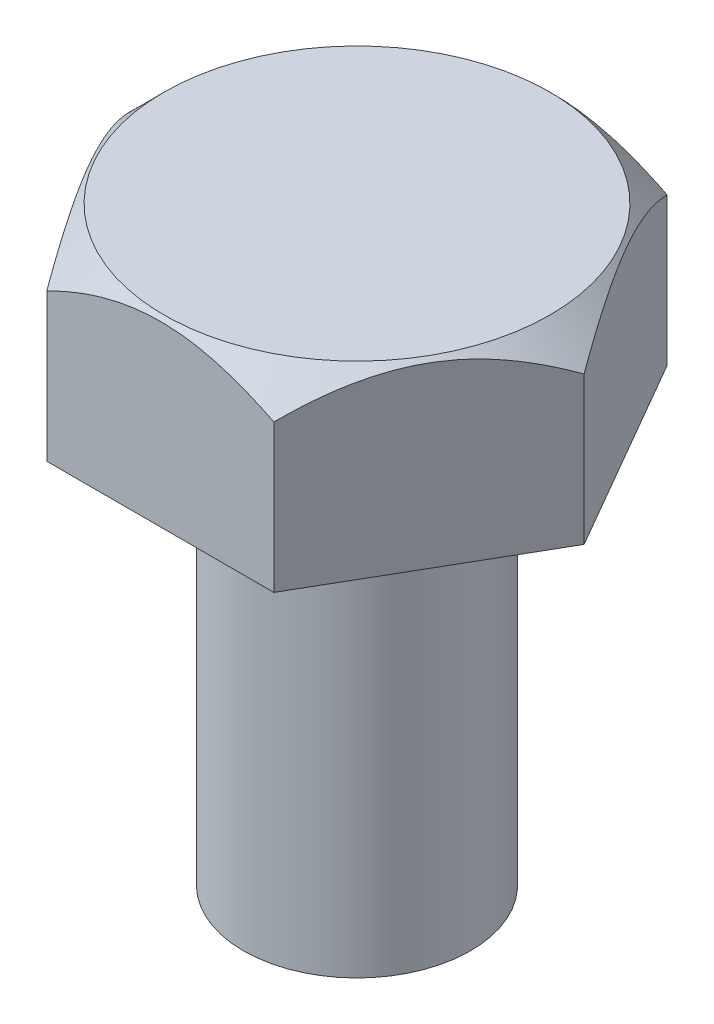
from build123d import *

# Parameters (mm, degrees)
SKETCH1_R           = 2.5
BOSS_EXTRUDE1_DEPTH = 9
BOSS_EXTRUDE2_DEPTH = 4


with BuildPart() as part:
    # Sketch1 → Boss-Extrude1 (new body)
    with BuildSketch(Plane(origin=(0, 0, 0), x_dir=(1, 0, 0), z_dir=(0, 1, 0))):
        with Locations(Location((0, 0, 0), (0, 0, 270))):
            Circle(SKETCH1_R)
    extrude(amount=BOSS_EXTRUDE1_DEPTH)

    # Sketch2 → Boss-Extrude2 (add)
    with BuildSketch(Plane(origin=(0, 9, 0), x_dir=(1, 0, 0), z_dir=(0, 1, 0))):
        Polygon((-2.5, 4.330127019), (-5, 0), (-2.5, -4.330127019), (2.5, -4.330127019), (5, 0), (2.5, 4.330127019), align=None)
    extrude(amount=BOSS_EXTRUDE2_DEPTH)

    # Sketch3 → Cut-Revolve1 (revolve, cut)
    with BuildSketch(Plane.XY):
        Polygon((4.25, 13), (5, 13), (5, 12.25), align=None)
    revolve(axis=Axis((0, 13, 0), (0, -1, 0)), mode=Mode.SUBTRACT)


solid = part.part
